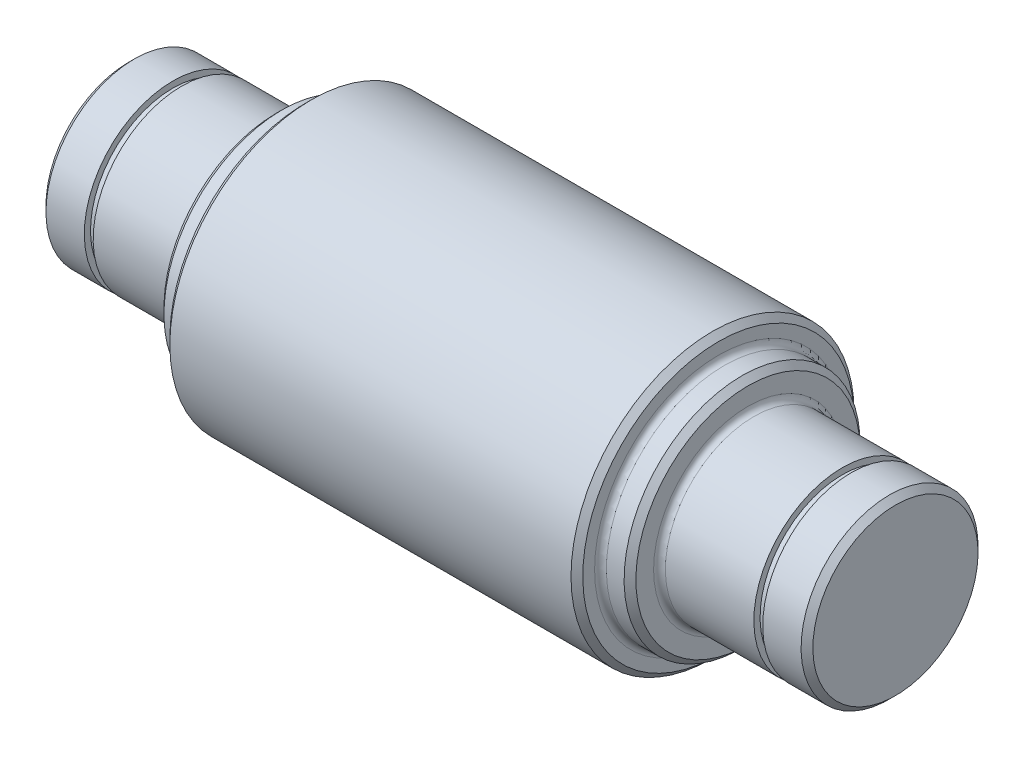
from build123d import *

# Parameters (mm, degrees)
M12_TAPPED_HOLE1_D           = 10.2
M12_TAPPED_HOLE1_DEPTH       = 16.935610843
M12_TAPPED_HOLE1_CSINK_D     = 12.05
M12_TAPPED_HOLE1_CSINK_ANGLE = 90
M12_TAPPED_HOLE1_TIP         = 3.064389157
FILLET1_R                    = 1
CHAMFER1_SIZE                = 1
SCALE1_SCALE                 = 0.625


with BuildPart() as part:
    # Sketch1 → Revolve1 (revolve)
    with BuildSketch(Plane.XY):
        Polygon((0, 0), (0, 24), (70, 24), (70, 20), (75, 20), (75, 15), (91, 15), (91, 13.95), (92.5, 13.95), (92.5, 15), (100, 15), (100, 0), align=None)
    revolve(axis=Axis((100, 0, 0), (-1, 0, 0)))

    # M12 Tapped Hole1
    with Locations(Plane.ZY):
        with Locations((0, 0)):
            CounterSinkHole(M12_TAPPED_HOLE1_D / 2, M12_TAPPED_HOLE1_CSINK_D / 2, depth=M12_TAPPED_HOLE1_DEPTH, counter_sink_angle=M12_TAPPED_HOLE1_CSINK_ANGLE)
            with Locations((0, 0, -(M12_TAPPED_HOLE1_DEPTH + M12_TAPPED_HOLE1_TIP / 2))):  # 118° drill point
                Cone(0, M12_TAPPED_HOLE1_D / 2, M12_TAPPED_HOLE1_TIP, mode=Mode.SUBTRACT)

    # Fillet1
    fillet1_edges = [part.edges().sort_by_distance(p)[0] for p in [
        (75, -15, 0),
        (70, -20, 0),
    ]]
    fillet(fillet1_edges, radius=FILLET1_R)

    # Chamfer1
    chamfer1_edges = [part.edges().sort_by_distance(p)[0] for p in [
        (75, -20, 0),
        (70, -24, 0),
        (0, -24, 0),
        (100, -15, 0),
    ]]
    chamfer(chamfer1_edges, length=CHAMFER1_SIZE)


with BuildPart() as part_1:
    # Scale1: scaled about (42.999626609, 0, 0)
    add(part.part.scale(SCALE1_SCALE).moved(Location((16.124859978, 0, 0))))

    # Mirror2: part across plane


with BuildPart() as part_2:
    add(part_1.part)
    add(part_1.part.mirror(Plane.ZY.offset(-37.999859978)))


solid = part_2.part
